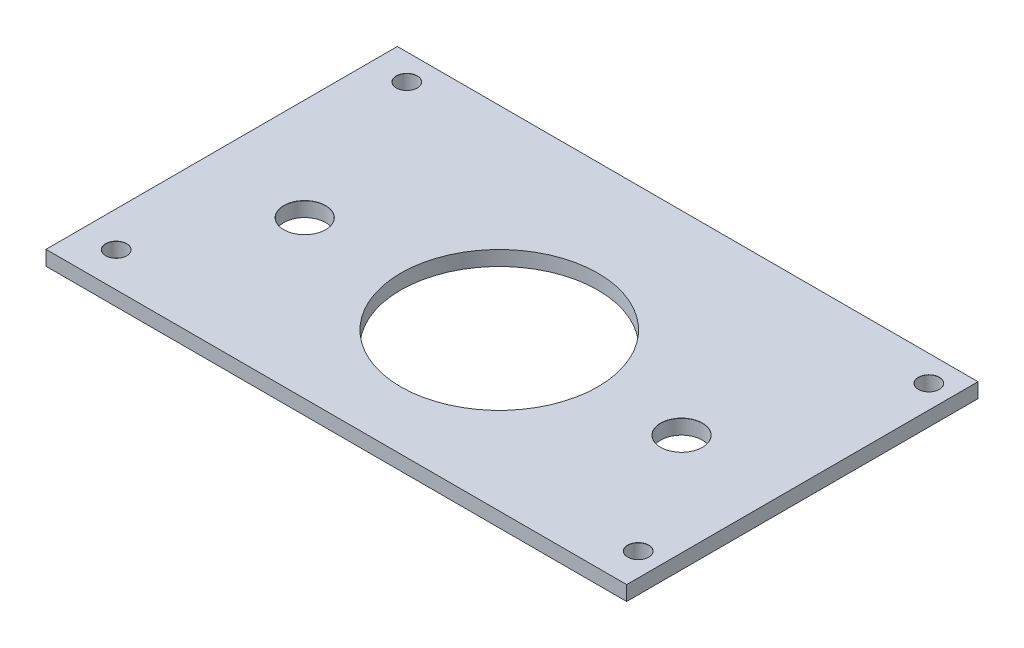
from build123d import *

# Parameters (mm, degrees)
SKETCH1_R                      = 21.275
BOSS_EXTRUDE1_DEPTH            = 3.175
M8_CLEARANCE_HOLE1_AT_2_COUNT  = 2
M8_CLEARANCE_HOLE1_AT_2_PITCH  = 81.35
SKETCH9_W                      = 125.35
SKETCH9_H                      = 8
SKETCH9_H_2                    = 2.5
BOSS_EXTRUDE2_DEPTH            = 3.175
M4_CLEARANCE_HOLE1_D           = 4.5
M4_CLEARANCE_HOLE1_CSINK_D     = 4.55
M4_CLEARANCE_HOLE1_CSINK_ANGLE = 90


with BuildPart() as part:
    # Sketch1 → Boss-Extrude1 (new body)
    with BuildSketch(Plane(origin=(0, 0, 0), x_dir=(1, 0, 0), z_dir=(0, 1, 0))):
        Polygon((-64, 0), (-64, 34), (61.35, 34), (61.35, 0), (61.35, -31.35), (-64, -31.35), align=None)
        with Locations(Location((0, 0, 0), (0, 0, 270))):
            Circle(SKETCH1_R, mode=Mode.SUBTRACT)
    extrude(amount=BOSS_EXTRUDE1_DEPTH)

    # Sketch4 → M8 Clearance Hole1 (revolve, cut)
    with BuildSketch(Plane(origin=(-42, 3.175, 0), x_dir=(0, 0, 1), z_dir=(1, 0, 0))):
        Polygon((0, 0), (0, 3.175), (4.5, 3.175), (4.5, 0.025), (4.525, 0), align=None)
    m8_clearance_hole1 = revolve(axis=Axis((-42, 9.525, 0), (0, -1, 0)), mode=Mode.SUBTRACT)

    # M8 Clearance Hole1 at 2: M8 Clearance Hole1 ×2
    with Locations(*[(i * M8_CLEARANCE_HOLE1_AT_2_PITCH, 0, 0) for i in range(1, M8_CLEARANCE_HOLE1_AT_2_COUNT)]):
        add(m8_clearance_hole1, mode=Mode.SUBTRACT)

    # Sketch9 → Boss-Extrude2 (add)
    with BuildSketch(Plane(origin=(0, 3.175, 0), x_dir=(1, 0, 0), z_dir=(0, 1, 0))):
        with Locations((-1.325, 38)):
            Rectangle(SKETCH9_W, SKETCH9_H)
        with Locations((-1.325, -32.6)):
            Rectangle(SKETCH9_W, SKETCH9_H_2)
    extrude(amount=-BOSS_EXTRUDE2_DEPTH)

    # M4 Clearance Hole1 (through all)
    with Locations(Plane(origin=(0, 3.175, 0), x_dir=(1, 0, 0), z_dir=(0, 1, 0))):
        with Locations((-56.35, 36.38795554), (-56.35, -26.35), (56.35, -26.35), (56.35, 36.38795554)):
            CounterSinkHole(M4_CLEARANCE_HOLE1_D / 2, M4_CLEARANCE_HOLE1_CSINK_D / 2, counter_sink_angle=M4_CLEARANCE_HOLE1_CSINK_ANGLE)


solid = part.part
